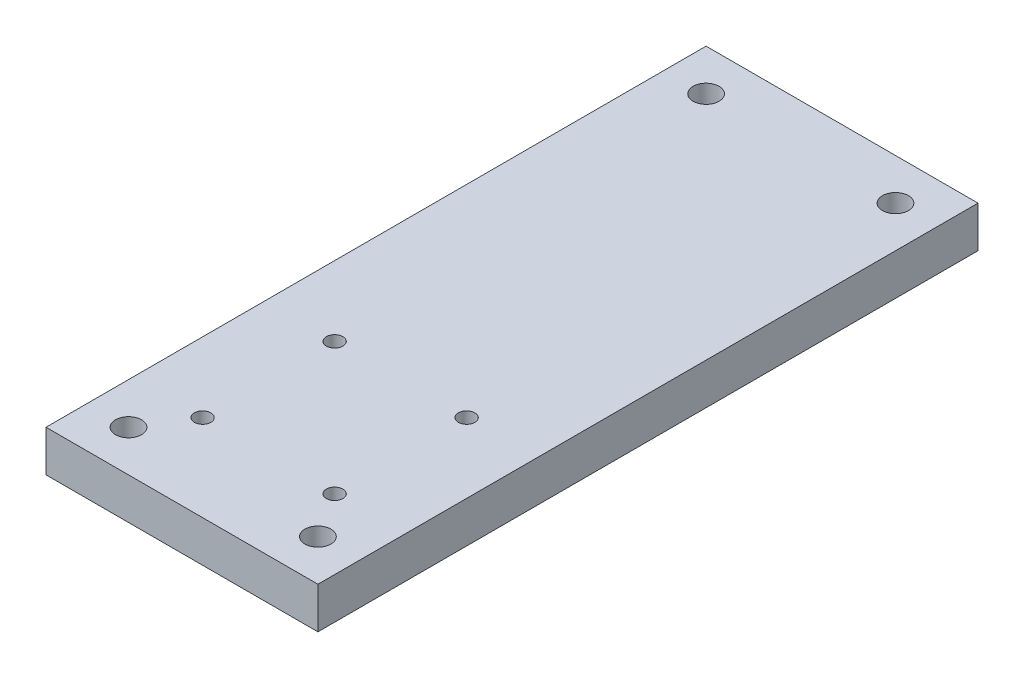
from build123d import *

# Parameters (mm, degrees)
SKETCH1_W           = 20
SKETCH1_H           = 40
BOSS_EXTRUDE1_DEPTH = 5
SKETCH3_W           = 20
SKETCH3_H           = 5
BOSS_EXTRUDE2_DEPTH = 33
SKETCH4_W           = 20
SKETCH4_H           = 3
CUT_EXTRUDE2_DEPTH  = 76.855125074
SKETCH5_W           = 20
SKETCH5_H           = 5
BOSS_EXTRUDE3_DEPTH = 10
SKETCH6_W           = 20
SKETCH6_H           = 5
BOSS_EXTRUDE4_DEPTH = 1.5
SKETCH7_W           = 20
SKETCH7_H           = 5
BOSS_EXTRUDE5_DEPTH = 1.5
SKETCH9_W           = 83
SKETCH9_H           = 5
BOSS_EXTRUDE7_DEPTH = 12.954
SKETCH10_R          = 1
CUT_EXTRUDE3_DEPTH  = 87.978445606
SKETCH11_W          = 32.954
SKETCH11_H          = 1.4986
SKETCH11_H_2        = 1.50368
CUT_EXTRUDE4_DEPTH  = 87.978445606
SKETCH12_R          = 1.575
CUT_EXTRUDE5_DEPTH  = 86.518355536


with BuildPart() as part:
    # Sketch1 → Boss-Extrude1 (new body)
    with BuildSketch(Plane(origin=(0, 0, 0), x_dir=(1, 0, 0), z_dir=(0, 1, 0))):
        with Locations((10, 20)):
            Rectangle(SKETCH1_W, SKETCH1_H)
    extrude(amount=BOSS_EXTRUDE1_DEPTH)

    # Sketch3 → Boss-Extrude2 (add)
    with BuildSketch(Plane(origin=(0, 0, -40), x_dir=(-1, 0, 0), z_dir=(0, 0, -1))):
        with Locations((-10, 2.5)):
            Rectangle(SKETCH3_W, SKETCH3_H)
    extrude(amount=BOSS_EXTRUDE2_DEPTH)

    # Sketch4 → Cut-Extrude2 (cut, through all)
    with BuildSketch(Plane(origin=(0, 5, 0), x_dir=(1, 0, 0), z_dir=(0, 1, 0))):
        with Locations((10, 1.5)):
            Rectangle(SKETCH4_W, SKETCH4_H)
    extrude(amount=-CUT_EXTRUDE2_DEPTH, mode=Mode.SUBTRACT)

    # Sketch5 → Boss-Extrude3 (add)
    with BuildSketch(Plane(origin=(0, 0, -73), x_dir=(-1, 0, 0), z_dir=(0, 0, -1))):
        with Locations((-10, 2.5)):
            Rectangle(SKETCH5_W, SKETCH5_H)
    extrude(amount=BOSS_EXTRUDE3_DEPTH)

    # Sketch6 → Boss-Extrude4 (add)
    with BuildSketch(Plane(origin=(0, 0, -83), x_dir=(-1, 0, 0), z_dir=(0, 0, -1))):
        with Locations((-10, 2.5)):
            Rectangle(SKETCH6_W, SKETCH6_H)
    extrude(amount=BOSS_EXTRUDE4_DEPTH)

    # Sketch7 → Boss-Extrude5 (add)
    with BuildSketch(Plane.XY.offset(-3)):
        with Locations((10, 2.5)):
            Rectangle(SKETCH7_W, SKETCH7_H)
    extrude(amount=BOSS_EXTRUDE5_DEPTH)

    # Sketch9 → Boss-Extrude7 (add)
    with BuildSketch(Plane.ZY):
        with Locations((-43, 2.5)):
            Rectangle(SKETCH9_W, SKETCH9_H)
    extrude(amount=BOSS_EXTRUDE7_DEPTH)

    # Sketch10 → Cut-Extrude3 (cut, through all)
    with BuildSketch(Plane.XZ):
        with Locations(Location((-4.477, -13.5, 0), (0, 0, 270))):
            Circle(SKETCH10_R)
        with Locations(Location((11.523, -13.5, 0), (0, 0, 270))):
            Circle(SKETCH10_R)
        with Locations(Location((11.523, -29.5, 0), (0, 0, 270))):
            Circle(SKETCH10_R)
        with Locations(Location((-4.477, -29.5, 0), (0, 0, 270))):
            Circle(SKETCH10_R)
    extrude(amount=-CUT_EXTRUDE3_DEPTH, mode=Mode.SUBTRACT)

    # Sketch11 → Cut-Extrude4 (cut, through all)
    with BuildSketch(Plane.XZ):
        with Locations((3.523, -2.2493)):
            Rectangle(SKETCH11_W, SKETCH11_H)
        with Locations((3.523, -83.74816)):
            Rectangle(SKETCH11_W, SKETCH11_H_2)
    extrude(amount=-CUT_EXTRUDE4_DEPTH, mode=Mode.SUBTRACT)

    # Sketch12 → Cut-Extrude5 (cut, through all)
    with BuildSketch(Plane.XZ):
        with Locations(Location((-7.954, -7.9986, 0), (0, 0, 270))):
            Circle(SKETCH12_R)
        with Locations(Location((15, -7.9986, 0), (0, 0, 270))):
            Circle(SKETCH12_R)
        with Locations(Location((15, -77.99632, 0), (0, 0, 270))):
            Circle(SKETCH12_R)
        with Locations(Location((-7.954, -77.99632, 0), (0, 0, 270))):
            Circle(SKETCH12_R)
    extrude(amount=-CUT_EXTRUDE5_DEPTH, mode=Mode.SUBTRACT)


solid = part.part
